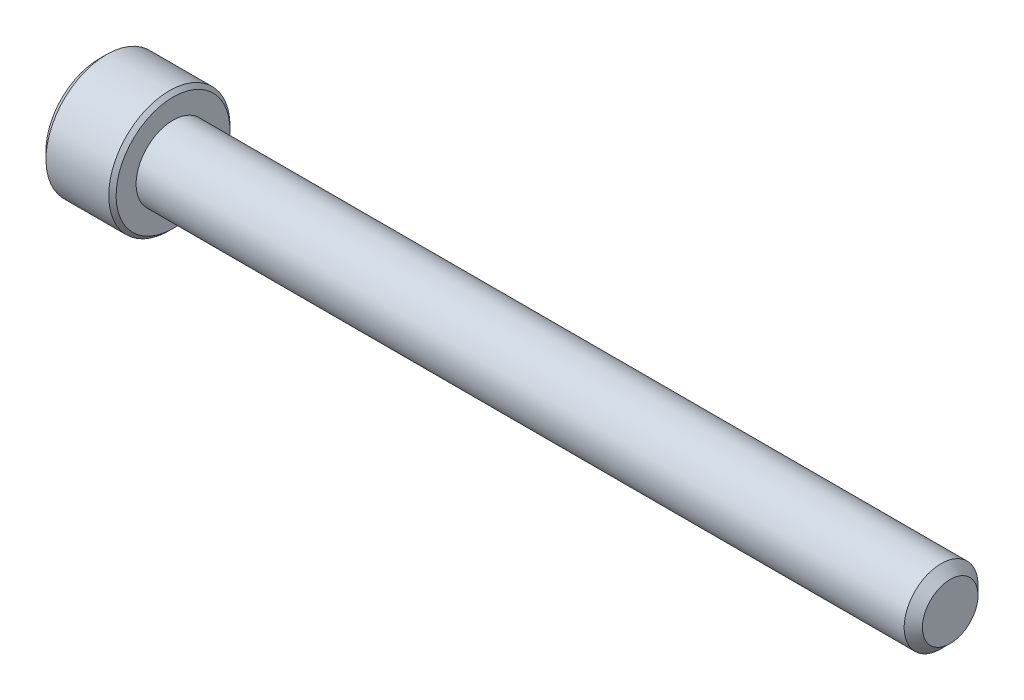
from build123d import *

# Parameters (mm, degrees)
SKETCH2_R           = 2.413
BOSS_EXTRUDE1_DEPTH = 50.8
CHAMFER1_SIZE       = 0.5953125
CUT_EXTRUDE1_DEPTH  = 2.286
SKETCH8_R           = 2.287692707
CUT_EXTRUDE2_DEPTH  = 0.9652
CUT_EXTRUDE2_DRAFT  = -45


with BuildPart() as part:
    # Sketch2 → Boss-Extrude1 (new body)
    with BuildSketch(Plane(origin=(25.4, 0, 0), x_dir=(0, 0, -1), z_dir=(1, 0, 0))):
        Circle(SKETCH2_R)
    extrude(amount=-BOSS_EXTRUDE1_DEPTH)

    # Chamfer1
    chamfer1_edges = [part.edges().sort_by_distance(p)[0] for p in [
        (25.4, 0, 2.413),
    ]]
    chamfer(chamfer1_edges, length=CHAMFER1_SIZE)

    # Sketch6 → Revolve1 (revolve)
    with BuildSketch(Plane.XY):
        Polygon((-29.7434, 3.9624), (-30.226, 3.4798), (-30.226, 0), (-25.4, 0), (-25.4, 3.7211), (-25.6413, 3.9624), align=None)
    revolve(axis=Axis((-25.4, 0, 0), (-1, 0, 0)))

    # Sketch4 → Cut-Extrude1 (cut)
    with BuildSketch(Plane(origin=(-30.226, 0, 0), x_dir=(0, 0, -1), z_dir=(1, 0, 0))):
        Polygon((0, 2.287692707), (-1.9812, 1.143846353), (-1.9812, -1.143846353), (0, -2.287692707), (1.9812, -1.143846353), (1.9812, 1.143846353), align=None)
    extrude(amount=CUT_EXTRUDE1_DEPTH, mode=Mode.SUBTRACT)


with BuildPart() as cut_extrude2_tool:
    # Sketch8 → Cut-Extrude2 (with draft: the straight prism first)
    with BuildSketch(Plane.ZY.offset(30.226)):
        Circle(SKETCH8_R)
    extrude(amount=-CUT_EXTRUDE2_DEPTH)
    # Cut-Extrude2: the draft: its side faces are tilted about the plane it starts from
    cut_extrude2_sides = [cut_extrude2_tool.faces().sort_by_distance(p)[0] for p in [
        (-29.7434, 0, -2.287692707),
    ]]
    draft(cut_extrude2_sides, Plane.ZY.offset(30.226), CUT_EXTRUDE2_DRAFT)


with BuildPart() as part_1:
    add(part.part)

    # Cut-Extrude2: cut by cut_extrude2_tool
    add(cut_extrude2_tool.part, mode=Mode.SUBTRACT)


solid = part_1.part
